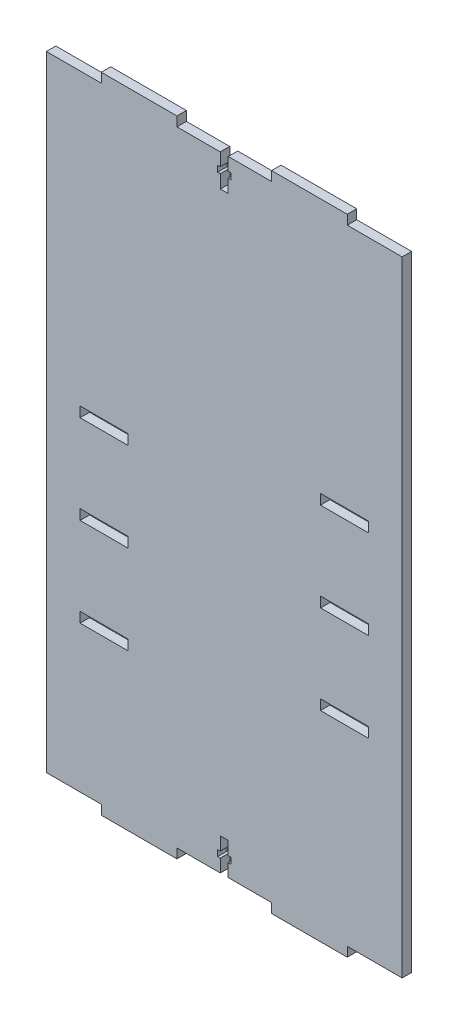
from build123d import *

# Parameters (mm, degrees)
SKETCH1_W           = 40
SKETCH1_H           = 5
BOSS_EXTRUDE2_DEPTH = 5
SKETCH2_W           = 25.4
SKETCH2_H           = 5.4
CUT_EXTRUDE1_DEPTH  = 5


with BuildPart() as part:
    # Sketch1 → Boss-Extrude2 (new body)
    with BuildSketch(Plane.XY):
        Polygon((-159, 330), (-188, 330), (-188, 0), (-159, 0), (-119, 0), (-96.1, 0), (-96.1, 6.8), (-97.5, 6.8), (-97.5, 10), (-96.1, 10), (-96.1, 17), (-91.9, 17), (-91.9, 10), (-90.5, 10), (-90.5, 6.8), (-91.9, 6.8), (-91.9, 0), (-69, 0), (-29, 0), (0, 0), (0, 330), (-29, 330), (-69, 330), (-91.9, 330), (-91.9, 323.2), (-90.5, 323.2), (-90.5, 320), (-91.9, 320), (-91.9, 313), (-96.1, 313), (-96.1, 320), (-97.5, 320), (-97.5, 323.2), (-96.1, 323.2), (-96.1, 330), (-119, 330), align=None)
        with Locations((-49, 332.5)):
            Rectangle(SKETCH1_W, SKETCH1_H)
        with Locations((-139, 332.5)):
            Rectangle(SKETCH1_W, SKETCH1_H)
        with Locations((-49, -2.5)):
            Rectangle(SKETCH1_W, SKETCH1_H)
        with Locations((-139, -2.5)):
            Rectangle(SKETCH1_W, SKETCH1_H)
    extrude(amount=BOSS_EXTRUDE2_DEPTH)

    # Sketch2 → Cut-Extrude1 (cut)
    with BuildSketch(Plane(origin=(0, 0, 0), x_dir=(-1, 0, 0), z_dir=(0, 0, -1))):
        with Locations((30.5, 197.500001815)):
            Rectangle(SKETCH2_W, SKETCH2_H)
        with Locations((157.5, 174.000000001)):
            Rectangle(SKETCH2_W, SKETCH2_H)
        with Locations((30.4, 150.500001815)):
            Rectangle(SKETCH2_W, SKETCH2_H)
        with Locations((157.5, 127)):
            Rectangle(SKETCH2_W, SKETCH2_H)
        with Locations((30.5, 103.500001815)):
            Rectangle(SKETCH2_W, SKETCH2_H)
        with Locations((157.5, 80)):
            Rectangle(SKETCH2_W, SKETCH2_H)
    extrude(amount=-CUT_EXTRUDE1_DEPTH, mode=Mode.SUBTRACT)


solid = part.part
